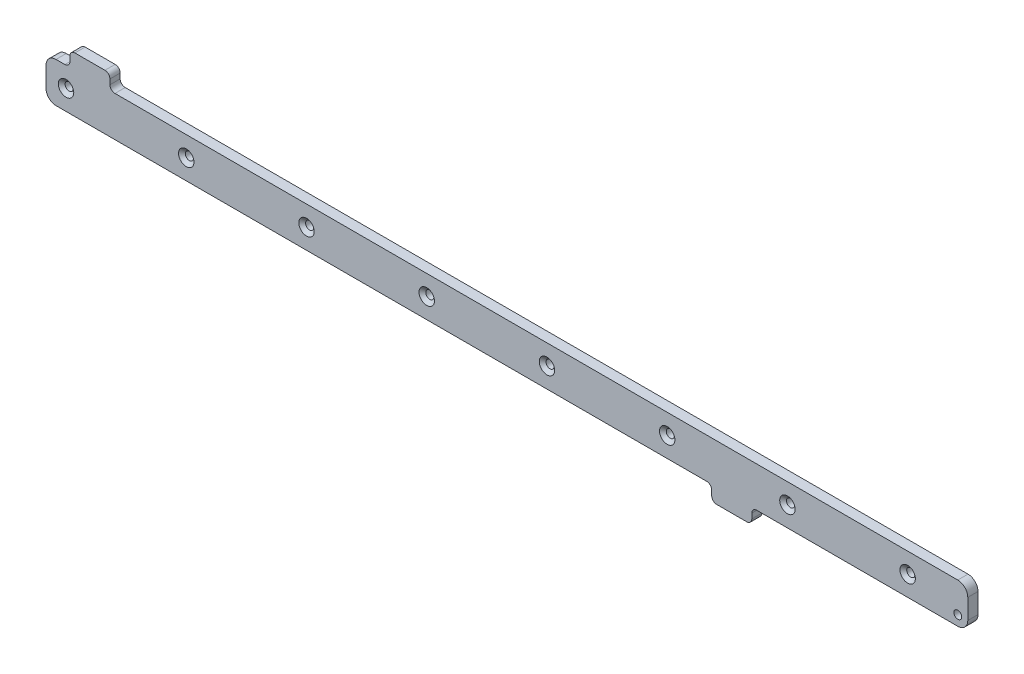
from build123d import *

# Parameters (mm, degrees)
SKETCH1_R                                          = 2.4892
BOSS_EXTRUDE1_DEPTH                                = 6.477
FILLET2_R                                          = 6.35
CSK_FOR_10_FLAT_HEAD_MACHINE_SCREW_100_D           = 5.1054
CSK_FOR_10_FLAT_HEAD_MACHINE_SCREW_100_CSINK_D     = 9.779
CSK_FOR_10_FLAT_HEAD_MACHINE_SCREW_100_CSINK_ANGLE = 100
LPATTERN1_COUNT                                    = 8
LPATTERN1_PITCH                                    = 76.2
FILLET3_R                                          = 3.175


with BuildPart() as part:
    # Sketch1 → Boss-Extrude1 (new body)
    with BuildSketch(Plane.XY):
        Polygon((0, 0), (40.53078, 0), (421.903292844, 0), (421.903292844, -9.525), (447.303292844, -9.525), (447.303292844, 0), (584.2, 0), (584.2, 25.4), (40.530665192, 25.4), (40.530665192, 34.925), (15.130665192, 34.925), (15.130665192, 25.4), (0, 25.4), align=None)
        with Locations((577.85, 6.35)):
            Circle(SKETCH1_R, mode=Mode.SUBTRACT)
    extrude(amount=BOSS_EXTRUDE1_DEPTH)

    # Fillet2
    fillet2_edges = [part.edges().sort_by_distance(p)[0] for p in [
        (0, 0, 3.2385),
        (0, 25.4, 3.2385),
        (584.2, 25.4, 3.2385),
        (584.2, 0, 3.2385),
    ]]
    fillet(fillet2_edges, radius=FILLET2_R)

    # CSK for #10 Flat Head Machine Screw (100)1 (through all)
    with Locations(Plane.XY.offset(6.477)):
        with Locations((546.1, 12.7)):
            csk_for_10_flat_head_machine_screw_100 = CounterSinkHole(CSK_FOR_10_FLAT_HEAD_MACHINE_SCREW_100_D / 2, CSK_FOR_10_FLAT_HEAD_MACHINE_SCREW_100_CSINK_D / 2, counter_sink_angle=CSK_FOR_10_FLAT_HEAD_MACHINE_SCREW_100_CSINK_ANGLE)

    # LPattern1: CSK for #10 Flat Head Machine Screw (100)1 ×8
    with Locations(*[(-i * LPATTERN1_PITCH, 0, 0) for i in range(1, LPATTERN1_COUNT)]):
        add(csk_for_10_flat_head_machine_screw_100, mode=Mode.SUBTRACT)

    # Fillet3
    fillet3_edges = [part.edges().sort_by_distance(p)[0] for p in [
        (447.303292844, -9.525, 3.2385),
        (421.903292844, -9.525, 3.2385),
        (421.903292844, 0, 3.2385),
        (15.130665192, 25.4, 3.2385),
        (15.130665192, 34.925, 3.2385),
        (40.530665192, 34.925, 3.2385),
        (40.530665192, 25.4, 3.2385),
        (447.303292844, 0, 3.2385),
    ]]
    fillet(fillet3_edges, radius=FILLET3_R)


solid = part.part
